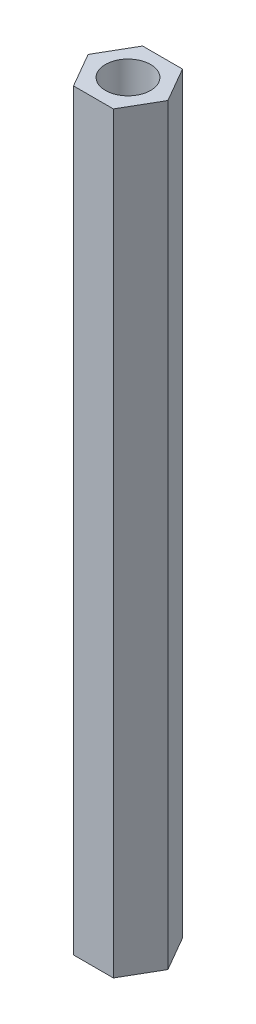
from build123d import *

# Parameters (mm, degrees)
SALIENTE_EXTRUIR1_DEPTH = 50
CROQUIS2_R              = 1.5
CORTAR_EXTRUIR1_DEPTH   = 50


with BuildPart() as part:
    # Croquis1 → Saliente-Extruir1 (new body)
    with BuildSketch(Plane(origin=(0, 0, 0), x_dir=(1, 0, 0), z_dir=(0, 1, 0))):
        Polygon((2.65, 0), (1.325, 2.29496732), (-1.325, 2.29496732), (-2.65, 0), (-1.325, -2.29496732), (1.325, -2.29496732), align=None)
    extrude(amount=SALIENTE_EXTRUIR1_DEPTH)

    # Croquis2 → Cortar-Extruir1 (cut)
    with BuildSketch(Plane(origin=(0, 50, 0), x_dir=(1, 0, 0), z_dir=(0, 1, 0))):
        with Locations(Location((0, 0, 0), (0, 0, 270))):
            Circle(CROQUIS2_R)
    extrude(amount=-CORTAR_EXTRUIR1_DEPTH, mode=Mode.SUBTRACT)


solid = part.part
